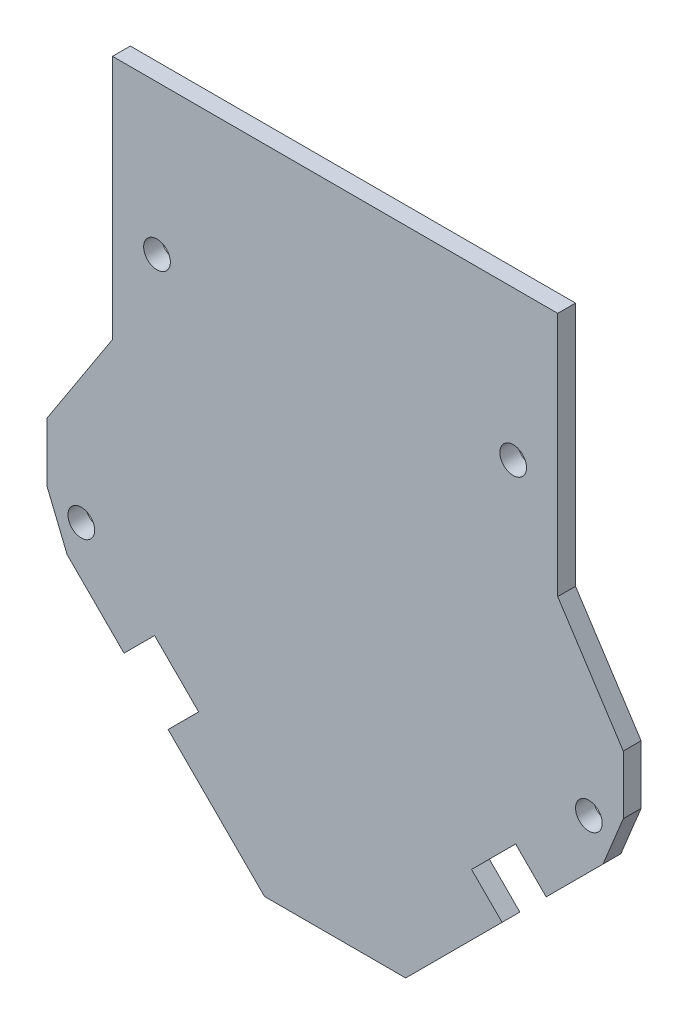
from build123d import *

# Parameters (mm, degrees)
EXTRUDE1_DEPTH  = 2
SKETCH4_R       = 1.5
EXTRUDE3_DEPTH  = 2
EXTRUDE5_DEPTH  = 2
FILLET2_R       = 3
SKETCH7_R       = 1.5
EXTRUDE6_DEPTH  = 2
EXTRUDE7_DEPTH  = 2
EXTRUDE8_DEPTH  = 2
EXTRUDE9_DEPTH  = 2
EXTRUDE10_DEPTH = 2
EXTRUDE11_DEPTH = 2
SKETCH13_W      = 52.444820885
SKETCH13_H      = 24.426279397
EXTRUDE12_DEPTH = 2
SKETCH14_R      = 1.5
EXTRUDE13_DEPTH = 2


with BuildPart() as part:
    # Sketch1 → Extrude1 (new body)
    with BuildSketch(Plane.XY):
        Polygon((-15, 13.5), (-15, 38.5), (15, 38.5), (15, 13.5), (26.811651575, -4.688348425), (15, -16.5), (15, -26.5), (7.928932188, -33.571067812), (7.928932188, -52.571067812), (-7.928932188, -52.571067812), (-7.928932188, -33.571067812), (-15, -26.5), (-15, -16.5), (-26.811651575, -4.688348425), align=None)
    extrude(amount=EXTRUDE1_DEPTH)

    # Sketch4 → Extrude3 (add)
    with BuildSketch(Plane.XY.offset(2)):
        Polygon((-26.811651575, -4.688348425), (-32.363678884, -6.963209468), (-30.088817841, -12.515236776), (-22.212122569, -9.287877431), align=None)
        with Locations((-28.5, -8.6)):
            Circle(SKETCH4_R, mode=Mode.SUBTRACT)
    extrude3 = extrude(amount=-EXTRUDE3_DEPTH)

    # Mirror1: Extrude3 across plane
    add(extrude3.mirror(Plane(origin=(0, 0, 0), x_dir=(0, 0, 1), z_dir=(1, 0, 0))))

    # Sketch6 → Extrude5 (add)
    with BuildSketch(Plane.XY.offset(2)):
        Polygon((0, -44.571067812), (-7.928932188, -44.571067812), (-18, -54.642135624), (18, -54.642135624), (7.928932188, -44.571067812), align=None)
    extrude(amount=-EXTRUDE5_DEPTH)

    # Fillet2
    fillet2_edges = [part.edges().sort_by_distance(p)[0] for p in [
        (18, -54.642135624, 1),
        (-18, -54.642135624, 1),
    ]]
    fillet(fillet2_edges, radius=FILLET2_R)

    # Sketch7 → Extrude6 (cut)
    with BuildSketch(Plane.XY.offset(2)):
        with Locations((-11, -52.002135624)):
            Circle(SKETCH7_R)
    extrude6 = extrude(amount=-EXTRUDE6_DEPTH, mode=Mode.SUBTRACT)

    # Mirror4: Extrude6 across plane
    add(extrude6.mirror(Plane(origin=(0, 0, 0), x_dir=(0, 0, 1), z_dir=(1, 0, 0))), mode=Mode.SUBTRACT)

    # Sketch8 → Extrude7 (add)
    with BuildSketch(Plane.XY.offset(2)):
        Polygon((-26.811651575, -4.688348425), (-32.363678884, -6.963209468), (-32.363678884, -0.385171544), (-15, 26.352549211), (-15, 13.5), align=None)
    extrude7 = extrude(amount=-EXTRUDE7_DEPTH)

    # Sketch9 → Extrude8 (add)
    with BuildSketch(Plane.XY.offset(2)):
        Polygon((-22.212122569, -9.287877431), (-25.22165278, -10.520987907), (-15, -20.742640687), (-15, -16.5), align=None)
    extrude8 = extrude(amount=-EXTRUDE8_DEPTH)

    # Sketch10 → Extrude9 (add)
    with BuildSketch(Plane.XY.offset(2)):
        Polygon((-25.22165278, -10.520987907), (-30.088817841, -12.515236776), (-23.702612277, -18.90144234), (-20.271905312, -15.470735375), align=None)
    extrude9 = extrude(amount=-EXTRUDE9_DEPTH)

    # Sketch11 → Extrude10 (add)
    with BuildSketch(Plane.XY.offset(2)):
        Polygon((-15.322157844, -20.420482843), (-18.752864809, -23.851189808), (-7.928932188, -34.675122429), (-7.928932188, -33.571067812), (-15, -26.5), (-15, -20.742640687), align=None)
    extrude10 = extrude(amount=-EXTRUDE10_DEPTH)

    # Sketch12 → Extrude11 (add)
    with BuildSketch(Plane.XY.offset(2)):
        Polygon((-25, 10.953899573), (-25, 38.5), (-15, 38.5), (-15, 26.352549211), align=None)
    extrude11 = extrude(amount=-EXTRUDE11_DEPTH)

    # Mirror5: Extrude7, Extrude8, Extrude9, Extrude10 across plane
    add(extrude7.mirror(Plane(origin=(0, 0, 0), x_dir=(0, 0, 1), z_dir=(1, 0, 0))))
    add(extrude8.mirror(Plane(origin=(0, 0, 0), x_dir=(0, 0, 1), z_dir=(1, 0, 0))))
    add(extrude9.mirror(Plane(origin=(0, 0, 0), x_dir=(0, 0, 1), z_dir=(1, 0, 0))))
    add(extrude10.mirror(Plane(origin=(0, 0, 0), x_dir=(0, 0, 1), z_dir=(1, 0, 0))))

    # Mirror6: Extrude11 across plane
    add(extrude11.mirror(Plane(origin=(0, 0, 0), x_dir=(0, 0, 1), z_dir=(1, 0, 0))))

    # Sketch13 → Extrude12 (cut)
    with BuildSketch(Plane(origin=(0, 0, 0), x_dir=(-1, 0, 0), z_dir=(0, 0, -1))):
        with Locations((1.088066824, -46.888262128)):
            Rectangle(SKETCH13_W, SKETCH13_H)
    extrude(amount=-EXTRUDE12_DEPTH, mode=Mode.SUBTRACT)

    # Sketch14 → Extrude13 (cut)
    with BuildSketch(Plane.XY.offset(2)):
        with Locations((-20, 21.73)):
            Circle(SKETCH14_R)
        with Locations((20, 21.73)):
            Circle(SKETCH14_R)
    extrude(amount=-EXTRUDE13_DEPTH, mode=Mode.SUBTRACT)


solid = part.part
